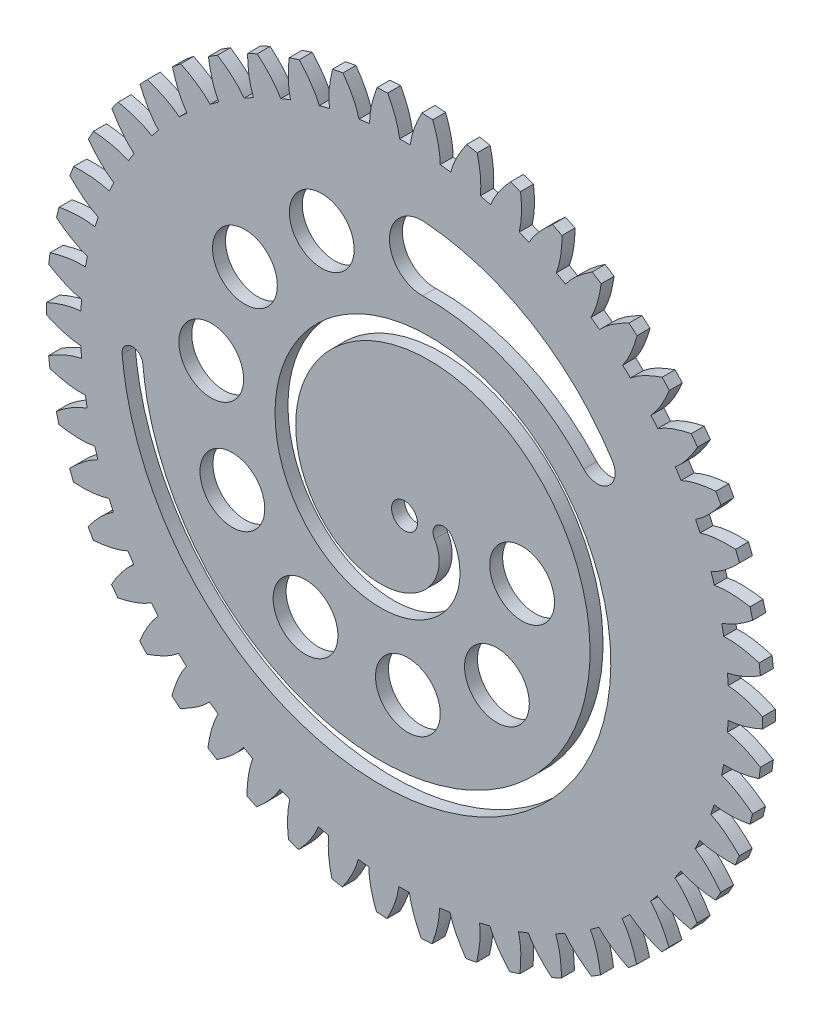
from build123d import *

# Parameters (mm, degrees)
SPIRALSKETCH_R      = 6.35
BOSS_EXTRUDE3_DEPTH = 6.35
SKETCH2_R           = 15.875
CUT_EXTRUDE1_DEPTH  = 6.35


with BuildPart() as part:
    # spiralSketch → Boss-Extrude3 (new body)
    with BuildSketch(Plane.XY):
        with BuildLine():
            Line((30.468459497, 172.815087406), (35.608653157, 171.829582085))
            add(Edge.make_bspline(
                [(37.148806911, 154.342245173), (37.831936538, 160.209299594), (36.978815149, 166.129159813), (35.608653157, 171.829582085)],
                knots=[0, 0, 0, 0, 1, 1, 1, 1], degree=3))
            ThreePointArc((37.148806911, 154.342245173), (39.66463326, 153.714928905), (42.169878451, 153.046606795))
            add(Edge.make_bspline(
                [(42.169878451, 153.046606795), (44.310689074, 158.5527263), (47.962178229, 163.294360615), (51.887680307, 167.633678274)],
                knots=[0, 0, 0, 0, 1, 1, 1, 1], degree=3))
            Line((51.887680307, 167.633678274), (56.863825436, 166.011706865))
            add(Edge.make_bspline(
                [(56.200090136, 148.469230377), (57.613169984, 154.204402477), (57.508730936, 160.184507291), (56.863825436, 166.011706865)],
                knots=[0, 0, 0, 0, 1, 1, 1, 1], degree=3))
            ThreePointArc((56.200090136, 148.469230377), (58.617454866, 147.531544034), (61.01918248, 146.554501362))
            add(Edge.make_bspline(
                [(61.01918248, 146.554501362), (63.833211933, 151.748888752), (68.050192367, 155.995480921), (72.488601402, 159.808585896)],
                knots=[0, 0, 0, 0, 1, 1, 1, 1], degree=3))
            Line((72.488601402, 159.808585896), (77.222221219, 157.575727856))
            add(Edge.make_bspline(
                [(74.365064367, 140.254767126), (76.485809323, 145.767609814), (77.131699681, 151.7136494), (77.222221219, 157.575727856)],
                knots=[0, 0, 0, 0, 1, 1, 1, 1], degree=3))
            ThreePointArc((74.365064367, 140.254767126), (76.645844193, 139.021498582), (78.90617755, 137.751143895))
            add(Edge.make_bspline(
                [(78.90617755, 137.751143895), (82.349046908, 142.551880579), (87.06501432, 146.236459307), (91.94633395, 149.463216654)],
                knots=[0, 0, 0, 0, 1, 1, 1, 1], degree=3))
            Line((91.94633395, 149.463216654), (96.362776443, 146.654685488))
            add(Edge.make_bspline(
                [(91.357257109, 129.828402414), (94.152221758, 135.031974868), (95.538255446, 140.850176629), (96.362776443, 146.654685488)],
                knots=[0, 0, 0, 0, 1, 1, 1, 1], degree=3))
            ThreePointArc((91.357257109, 129.828402414), (93.46548277, 128.31900105), (95.548775063, 126.775368601))
            add(Edge.make_bspline(
                [(95.548775063, 126.775368601), (99.566188221, 131.106744093), (104.706768987, 134.171201371), (109.954017886, 136.7607232)],
                knots=[0, 0, 0, 0, 1, 1, 1, 1], degree=3))
            Line((109.954017886, 136.7607232), (113.983633118, 133.420811122))
            add(Edge.make_bspline(
                [(106.908691333, 117.35456624), (110.333797412, 122.166805014), (112.438115851, 127.765412432), (113.983633118, 133.420811122)],
                knots=[0, 0, 0, 0, 1, 1, 1, 1], degree=3))
            ThreePointArc((106.908691333, 117.35456624), (108.811114851, 115.592836218), (110.684511316, 113.800270012))
            add(Edge.make_bspline(
                [(110.684511316, 113.800270012), (115.213111267, 117.593975932), (120.697235358, 119.98998344), (126.227661276, 121.901431444)],
                knots=[0, 0, 0, 0, 1, 1, 1, 1], degree=3))
            Line((126.227661276, 121.901431444), (129.806899808, 118.082810864))
            add(Edge.make_bspline(
                [(120.77411163, 103.029978452), (124.775343171, 107.374991666), (127.564760002, 112.665711358), (129.806899808, 118.082810864)],
                knots=[0, 0, 0, 0, 1, 1, 1, 1], degree=3))
            ThreePointArc((120.77411163, 103.029978452), (122.44073065, 101.043703306), (124.074686705, 99.030473184))
            add(Edge.make_bspline(
                [(124.074686705, 99.030473184), (129.043054723, 102.226680524), (134.784234227, 103.916451792), (140.510619044, 105.119681294)],
                knots=[0, 0, 0, 0, 1, 1, 1, 1], degree=3))
            Line((140.510619044, 105.119681294), (143.583034146, 100.882574138))
            add(Edge.make_bspline(
                [(132.73485204, 87.080546357), (137.249107231, 90.889810556), (140.679631683, 95.789204712), (143.583034146, 100.882574138)],
                knots=[0, 0, 0, 0, 1, 1, 1, 1], degree=3))
            ThreePointArc((132.73485204, 87.080546357), (134.139382985, 84.901050833), (135.508130167, 82.698906635))
            add(Edge.make_bspline(
                [(135.508130167, 82.698906635), (140.83791212, 85.247209297), (146.745605205, 86.204095622), (152.577640412, 86.680130974)],
                knots=[0, 0, 0, 0, 1, 1, 1, 1], degree=3))
            Line((152.577640412, 86.680130974), (155.094778262, 82.091358955))
            add(Edge.make_bspline(
                [(142.602284541, 69.757802027), (147.558370882, 72.97124284), (151.575901536, 77.402045087), (155.094778262, 82.091358955)],
                knots=[0, 0, 0, 0, 1, 1, 1, 1], degree=3))
            ThreePointArc((142.602284541, 69.757802027), (143.722577118, 67.419458071), (144.804529467, 65.063128928))
            add(Edge.make_bspline(
                [(144.804529467, 65.063128928), (150.41167151, 66.923338655), (156.392710328, 67.132249368), (162.238421245, 66.873583209)],
                knots=[0, 0, 0, 0, 1, 1, 1, 1], degree=3))
            Line((162.238421245, 66.873583209), (164.160585077, 62.005514001))
            add(Edge.make_bspline(
                [(150.220793829, 51.334935487), (155.540550876, 53.901875032), (160.081728874, 57.794208973), (164.160585077, 62.005514001)],
                knots=[0, 0, 0, 0, 1, 1, 1, 1], degree=3))
            ThreePointArc((150.220793829, 51.334935487), (151.039180355, 48.87462018), (151.817274835, 46.40126681))
            add(Edge.make_bspline(
                [(151.817274835, 46.40126681), (157.613348989, 47.544046985), (163.573408985, 47.001687439), (169.340605259, 46.012399088)],
                knots=[0, 0, 0, 0, 1, 1, 1, 1], degree=3))
            Line((169.340605259, 46.012399088), (170.6374814, 40.941805052))
            add(Edge.make_bspline(
                [(155.47023146, 32.102486348), (161.069763468, 33.982442456), (166.062971719, 37.274923658), (170.6374814, 40.941805052)],
                knots=[0, 0, 0, 0, 1, 1, 1, 1], degree=3))
            ThreePointArc((155.47023146, 32.102486348), (155.973805491, 29.559000333), (156.435771088, 27.007628995))
            add(Edge.make_bspline(
                [(156.435771088, 27.007628995), (162.329369801, 27.414957292), (168.174457268, 26.129880822), (173.772186769, 24.425571947)],
                knots=[0, 0, 0, 0, 1, 1, 1, 1], degree=3))
            Line((173.772186769, 24.425571947), (174.423322707, 19.232419379))
            add(Edge.make_bspline(
                [(158.267810668, 12.363761823), (164.058809671, 13.527086463), (169.4253023, 16.167790531), (174.423322707, 19.232419379)],
                knots=[0, 0, 0, 0, 1, 1, 1, 1], degree=3))
            ThreePointArc((158.267810668, 12.363761823), (158.44863054, 9.777217393), (158.587181781, 7.188064738))
            add(Edge.make_bspline(
                [(158.587181781, 7.188064738), (164.48535948, 6.853517346), (170.123293897, 4.845990375), (175.463277087, 2.453538945)],
                knots=[0, 0, 0, 0, 1, 1, 1, 1], degree=3))
            Line((175.463277087, 2.453538945), (175.45840402, -2.780273036))
            add(Edge.make_bspline(
                [(158.569411957, -7.569946612), (164.460550442, -7.141599765), (170.115694653, -5.194318311), (175.45840402, -2.780273036)],
                knots=[0, 0, 0, 0, 1, 1, 1, 1], degree=3))
            ThreePointArc((158.569411957, -7.569946612), (158.424626033, -10.158758106), (158.237577882, -12.744859593))
            add(Edge.make_bspline(
                [(158.237577882, -12.744859593), (164.047316782, -13.816006663), (169.389184555, -16.514324235), (174.387206708, -19.557187831)],
                knots=[0, 0, 0, 0, 1, 1, 1, 1], degree=3))
            Line((174.387206708, -19.557187831), (173.726401487, -24.749118884))
            add(Edge.make_bspline(
                [(156.370278894, -27.384272467), (162.268650088, -27.697658698), (168.12326088, -26.474509651), (173.726401487, -24.749118884)],
                knots=[0, 0, 0, 0, 1, 1, 1, 1], degree=3))
            ThreePointArc((156.370278894, -27.384272467), (155.902170535, -29.934523921), (155.392472853, -32.476789876))
            add(Edge.make_bspline(
                [(155.392472853, -32.476789876), (161.0221499, -34.267643994), (165.983706584, -37.614198087), (170.560945906, -41.259486073)],
                knots=[0, 0, 0, 0, 1, 1, 1, 1], degree=3))
            Line((170.560945906, -41.259486073), (169.254629824, -46.327656344))
            add(Edge.make_bspline(
                [(151.705093123, -46.766731986), (157.517676188, -47.816909008), (163.47942285, -47.337182158), (169.254629824, -46.327656344)],
                knots=[0, 0, 0, 0, 1, 1, 1, 1], degree=3))
            ThreePointArc((151.705093123, -46.766731986), (150.921044677, -49.238204412), (150.0967357, -51.696541782))
            add(Edge.make_bspline(
                [(150.0967357, -51.696541782), (155.457567525, -54.178860108), (159.960566406, -58.120873566), (164.044837099, -62.311097571)],
                knots=[0, 0, 0, 0, 1, 1, 1, 1], degree=3))
            Line((164.044837099, -62.311097571), (162.113611541, -67.175578988))
            add(Edge.make_bspline(
                [(144.647427408, -65.411652205), (150.282554438, -67.182058099), (156.257416664, -67.453319025), (162.113611541, -67.175578988)],
                knots=[0, 0, 0, 0, 1, 1, 1, 1], degree=3))
            ThreePointArc((144.647427408, -65.411652205), (143.559803788, -67.765369005), (142.433883362, -70.101008342))
            add(Edge.make_bspline(
                [(142.433883362, -70.101008342), (147.441326444, -73.235643234), (151.414752541, -77.710948148), (154.941643215, -82.380025839)],
                knots=[0, 0, 0, 0, 1, 1, 1, 1], degree=3))
            Line((154.941643215, -82.380025839), (152.415964762, -86.964102622))
            add(Edge.make_bspline(
                [(135.308585355, -83.024991594), (140.67738703, -85.487706), (146.571137674, -86.505676756), (152.415964762, -86.964102622)],
                knots=[0, 0, 0, 0, 1, 1, 1, 1], degree=3))
            ThreePointArc((135.308585355, -83.024991594), (133.934539034, -85.223833249), (132.524763597, -87.399940124))
            add(Edge.make_bspline(
                [(132.524763597, -87.399940124), (137.099847567, -91.137456517), (140.481037577, -96.075474656), (143.39492706, -101.149771887)],
                knots=[0, 0, 0, 0, 1, 1, 1, 1], degree=3))
            Line((143.39492706, -101.149771887), (140.31462717, -105.381150409))
            add(Edge.make_bspline(
                [(123.835846082, -99.328977268), (128.853653192, -102.445161711), (134.573344285, -104.193788289), (140.31462717, -105.381150409)],
                knots=[0, 0, 0, 0, 1, 1, 1, 1], degree=3))
            ThreePointArc((123.835846082, -99.328977268), (122.197046592, -101.338266732), (120.525649144, -103.32052264))
            add(Edge.make_bspline(
                [(120.525649144, -103.32052264), (124.596222196, -107.601977667), (127.331852731, -112.924833536), (129.586787245, -118.324325609)],
                knots=[0, 0, 0, 0, 1, 1, 1, 1], degree=3))
            Line((129.586787245, -118.324325609), (126.000444087, -122.136274501))
            add(Edge.make_bspline(
                [(110.41014154, -114.066485635), (114.99782027, -117.786996023), (120.453248867, -120.238701538), (126.000444087, -122.136274501)],
                knots=[0, 0, 0, 0, 1, 1, 1, 1], degree=3))
            ThreePointArc((110.41014154, -114.066485635), (108.532433728, -115.854535212), (106.625773205, -117.611678793))
            add(Edge.make_bspline(
                [(106.625773205, -117.611678793), (110.12763997, -122.369551352), (112.174568503, -127.993300333), (113.734986384, -133.632834032)],
                knots=[0, 0, 0, 0, 1, 1, 1, 1], degree=3))
            Line((113.734986384, -133.632834032), (109.699158732, -136.965236585))
            add(Edge.make_bspline(
                [(95.24320311, -127.005097383), (99.328403025, -131.271259045), (104.433533758, -134.387378636), (109.699158732, -136.965236585)],
                knots=[0, 0, 0, 0, 1, 1, 1, 1], degree=3))
            ThreePointArc((95.24320311, -127.005097383), (93.15619955, -128.543708463), (91.044345128, -130.048028514))
            add(Edge.make_bspline(
                [(91.044345128, -130.048028514), (93.922279074, -135.207284112), (95.24822432, -141.043236325), (96.089516846, -146.833872835)],
                knots=[0, 0, 0, 0, 1, 1, 1, 1], degree=3))
            Line((96.089516846, -146.833872835), (91.667852113, -149.634175068))
            add(Edge.make_bspline(
                [(78.574222471, -137.940762877), (82.092517529, -142.685295895), (86.766839437, -146.416686495), (91.667852113, -149.634175068)],
                knots=[0, 0, 0, 0, 1, 1, 1, 1], degree=3))
            ThreePointArc((78.574222471, -137.940762877), (76.310836456, -139.205670644), (74.02709334, -140.433443138))
            add(Edge.make_bspline(
                [(74.02709334, -140.433443138), (76.235707731, -145.912717232), (76.819758741, -151.868836224), (76.928658226, -157.719253748)],
                knots=[0, 0, 0, 0, 1, 1, 1, 1], degree=3))
            Line((76.928658226, -157.719253748), (72.190888706, -159.943293223))
            add(Edge.make_bspline(
                [(60.666079407, -146.701020138), (63.561983992, -151.849100392), (67.731780226, -156.136915742), (72.190888706, -159.943293223)],
                knots=[0, 0, 0, 0, 1, 1, 1, 1], degree=3))
            ThreePointArc((60.666079407, -146.701020138), (58.262005885, -147.672276241), (55.84239007, -148.604138473))
            add(Edge.make_bspline(
                [(55.84239007, -148.604138473), (57.346853736, -154.317019638), (57.179799677, -160.299373854), (56.55458871, -166.117307813)],
                knots=[0, 0, 0, 0, 1, 1, 1, 1], degree=3))
            Line((56.55458871, -166.117307813), (51.57543186, -167.730010099))
            add(Edge.make_bspline(
                [(41.801196029, -153.147714676), (44.029039997, -158.618153866), (47.62855038, -163.394772556), (51.57543186, -167.730010099)],
                knots=[0, 0, 0, 0, 1, 1, 1, 1], degree=3))
            ThreePointArc((41.801196029, -153.147714676), (39.294348678, -153.810001827), (36.777018949, -154.431257773))
            add(Edge.make_bspline(
                [(36.777018949, -154.431257773), (37.553605601, -160.287650459), (36.638081014, -166.2018946), (35.288619547, -171.8955927)],
                knots=[0, 0, 0, 0, 1, 1, 1, 1], degree=3))
            Line((35.288619547, -171.8955927), (30.146599644, -172.871524518))
            add(Edge.make_bspline(
                [(22.27708282, -157.179178268), (23.80173174, -162.885704299), (26.774189842, -168.0757962), (30.146599644, -172.871524518)],
                knots=[0, 0, 0, 0, 1, 1, 1, 1], degree=3))
            ThreePointArc((22.27708282, -157.179178268), (19.706996118, -157.522051802), (17.131652269, -157.822903884))
            add(Edge.make_bspline(
                [(17.131652269, -157.822903884), (17.168114671, -163.730449282), (15.518557928, -169.483312184), (13.466127773, -174.962981405)],
                knots=[0, 0, 0, 0, 1, 1, 1, 1], degree=3))
            Line((13.466127773, -174.962981405), (8.242337542, -175.286751727))
            add(Edge.make_bspline(
                [(2.401646707, -158.731832325), (3.199055955, -164.584449872), (5.497584337, -170.106164134), (8.242337542, -175.286751727)],
                knots=[0, 0, 0, 0, 1, 1, 1, 1], degree=3))
            ThreePointArc((2.401646707, -158.731832325), (-0.191147542, -158.749884922), (-2.7838908, -158.725588523))
            add(Edge.make_bspline(
                [(-2.7838908, -158.725588523), (-3.488127682, -164.591121111), (-5.845702088, -170.091876691), (-8.56873288, -175.271099375)],
                knots=[0, 0, 0, 0, 1, 1, 1, 1], degree=3))
            Line((-8.56873288, -175.271099375), (-13.791911146, -174.937602151))
            add(Edge.make_bspline(
                [(-17.51166481, -157.781190563), (-17.454070854, -163.687600353), (-15.865721358, -169.453856244), (-13.791911146, -174.937602151)],
                knots=[0, 0, 0, 0, 1, 1, 1, 1], degree=3))
            ThreePointArc((-17.51166481, -157.781190563), (-20.086276692, -157.474137523), (-22.655530249, -157.125075813))
            add(Edge.make_bspline(
                [(-22.655530249, -157.125075813), (-24.089360178, -162.856092639), (-27.11777189, -168.017990694), (-30.468459497, -172.815087406)],
                knots=[0, 0, 0, 0, 1, 1, 1, 1], degree=3))
            Line((-30.468459497, -172.815087406), (-35.608653157, -171.829582085))
            add(Edge.make_bspline(
                [(-37.148806911, -154.342245173), (-37.831936538, -160.209299595), (-36.978815149, -166.129159813), (-35.608653157, -171.829582085)],
                knots=[0, 0, 0, 0, 1, 1, 1, 1], degree=3))
            ThreePointArc((-37.148806911, -154.342245173), (-39.664633259, -153.714928905), (-42.169878451, -153.046606795))
            add(Edge.make_bspline(
                [(-42.169878451, -153.046606795), (-44.310689074, -158.5527263), (-47.962178229, -163.294360615), (-51.887680306, -167.633678274)],
                knots=[0, 0, 0, 0, 1, 1, 1, 1], degree=3))
            Line((-51.887680306, -167.633678274), (-56.863825436, -166.011706865))
            add(Edge.make_bspline(
                [(-56.200090136, -148.469230377), (-57.613169984, -154.204402477), (-57.508730936, -160.184507291), (-56.863825436, -166.011706865)],
                knots=[0, 0, 0, 0, 1, 1, 1, 1], degree=3))
            ThreePointArc((-56.200090136, -148.469230377), (-58.617454866, -147.531544034), (-61.01918248, -146.554501362))
            add(Edge.make_bspline(
                [(-61.01918248, -146.554501362), (-63.833211933, -151.748888752), (-68.050192367, -155.995480921), (-72.488601402, -159.808585896)],
                knots=[0, 0, 0, 0, 1, 1, 1, 1], degree=3))
            Line((-72.488601402, -159.808585896), (-77.222221219, -157.575727856))
            add(Edge.make_bspline(
                [(-74.365064367, -140.254767126), (-76.485809323, -145.767609815), (-77.131699681, -151.7136494), (-77.222221219, -157.575727856)],
                knots=[0, 0, 0, 0, 1, 1, 1, 1], degree=3))
            ThreePointArc((-74.365064367, -140.254767126), (-76.645844193, -139.021498582), (-78.90617755, -137.751143896))
            add(Edge.make_bspline(
                [(-78.90617755, -137.751143896), (-82.349046908, -142.551880579), (-87.06501432, -146.236459307), (-91.94633395, -149.463216654)],
                knots=[0, 0, 0, 0, 1, 1, 1, 1], degree=3))
            Line((-91.94633395, -149.463216654), (-96.362776443, -146.654685488))
            add(Edge.make_bspline(
                [(-91.357257109, -129.828402414), (-94.152221758, -135.031974868), (-95.538255446, -140.850176629), (-96.362776443, -146.654685488)],
                knots=[0, 0, 0, 0, 1, 1, 1, 1], degree=3))
            ThreePointArc((-91.357257109, -129.828402414), (-93.46548277, -128.31900105), (-95.548775063, -126.775368601))
            add(Edge.make_bspline(
                [(-95.548775063, -126.775368601), (-99.566188221, -131.106744093), (-104.706768987, -134.171201371), (-109.954017886, -136.7607232)],
                knots=[0, 0, 0, 0, 1, 1, 1, 1], degree=3))
            Line((-109.954017886, -136.7607232), (-113.983633118, -133.420811122))
            add(Edge.make_bspline(
                [(-106.908691333, -117.35456624), (-110.333797412, -122.166805014), (-112.438115851, -127.765412432), (-113.983633118, -133.420811122)],
                knots=[0, 0, 0, 0, 1, 1, 1, 1], degree=3))
            ThreePointArc((-106.908691333, -117.35456624), (-108.811114851, -115.592836218), (-110.684511316, -113.800270012))
            add(Edge.make_bspline(
                [(-110.684511316, -113.800270012), (-115.213111267, -117.593975932), (-120.697235358, -119.98998344), (-126.227661276, -121.901431444)],
                knots=[0, 0, 0, 0, 1, 1, 1, 1], degree=3))
            Line((-126.227661276, -121.901431444), (-129.806899808, -118.082810864))
            add(Edge.make_bspline(
                [(-120.77411163, -103.029978452), (-124.775343171, -107.374991666), (-127.564760002, -112.665711358), (-129.806899808, -118.082810864)],
                knots=[0, 0, 0, 0, 1, 1, 1, 1], degree=3))
            ThreePointArc((-120.77411163, -103.029978452), (-122.44073065, -101.043703306), (-124.074686705, -99.030473184))
            add(Edge.make_bspline(
                [(-124.074686705, -99.030473184), (-129.043054723, -102.226680524), (-134.784234227, -103.916451792), (-140.510619044, -105.119681294)],
                knots=[0, 0, 0, 0, 1, 1, 1, 1], degree=3))
            Line((-140.510619044, -105.119681294), (-143.583034146, -100.882574138))
            add(Edge.make_bspline(
                [(-132.73485204, -87.080546357), (-137.249107231, -90.889810557), (-140.679631683, -95.789204712), (-143.583034146, -100.882574138)],
                knots=[0, 0, 0, 0, 1, 1, 1, 1], degree=3))
            ThreePointArc((-132.73485204, -87.080546357), (-134.139382985, -84.901050833), (-135.508130167, -82.698906636))
            add(Edge.make_bspline(
                [(-135.508130167, -82.698906636), (-140.83791212, -85.247209297), (-146.745605205, -86.204095622), (-152.577640412, -86.680130974)],
                knots=[0, 0, 0, 0, 1, 1, 1, 1], degree=3))
            Line((-152.577640412, -86.680130974), (-155.094778262, -82.091358955))
            add(Edge.make_bspline(
                [(-142.602284541, -69.757802027), (-147.558370882, -72.97124284), (-151.575901536, -77.402045087), (-155.094778262, -82.091358955)],
                knots=[0, 0, 0, 0, 1, 1, 1, 1], degree=3))
            ThreePointArc((-142.602284541, -69.757802027), (-143.722577118, -67.419458071), (-144.804529467, -65.063128928))
            add(Edge.make_bspline(
                [(-144.804529467, -65.063128928), (-150.41167151, -66.923338655), (-156.392710328, -67.132249368), (-162.238421245, -66.873583209)],
                knots=[0, 0, 0, 0, 1, 1, 1, 1], degree=3))
            Line((-162.238421245, -66.873583209), (-164.160585077, -62.005514001))
            add(Edge.make_bspline(
                [(-150.220793829, -51.334935487), (-155.540550876, -53.901875032), (-160.081728874, -57.794208973), (-164.160585077, -62.005514001)],
                knots=[0, 0, 0, 0, 1, 1, 1, 1], degree=3))
            ThreePointArc((-150.220793829, -51.334935487), (-151.039180355, -48.87462018), (-151.817274835, -46.40126681))
            add(Edge.make_bspline(
                [(-151.817274835, -46.40126681), (-157.613348989, -47.544046985), (-163.573408985, -47.001687439), (-169.340605259, -46.012399088)],
                knots=[0, 0, 0, 0, 1, 1, 1, 1], degree=3))
            Line((-169.340605259, -46.012399088), (-170.6374814, -40.941805052))
            add(Edge.make_bspline(
                [(-155.47023146, -32.102486348), (-161.069763468, -33.982442456), (-166.062971719, -37.274923658), (-170.6374814, -40.941805052)],
                knots=[0, 0, 0, 0, 1, 1, 1, 1], degree=3))
            ThreePointArc((-155.47023146, -32.102486348), (-155.973805491, -29.559000333), (-156.435771088, -27.007628996))
            add(Edge.make_bspline(
                [(-156.435771088, -27.007628996), (-162.329369801, -27.414957292), (-168.174457268, -26.129880822), (-173.772186769, -24.425571947)],
                knots=[0, 0, 0, 0, 1, 1, 1, 1], degree=3))
            Line((-173.772186769, -24.425571947), (-174.423322707, -19.232419379))
            add(Edge.make_bspline(
                [(-158.267810668, -12.363761823), (-164.058809671, -13.527086463), (-169.4253023, -16.167790531), (-174.423322707, -19.232419379)],
                knots=[0, 0, 0, 0, 1, 1, 1, 1], degree=3))
            ThreePointArc((-158.267810668, -12.363761823), (-158.44863054, -9.777217393), (-158.587181781, -7.188064739))
            add(Edge.make_bspline(
                [(-158.587181781, -7.188064739), (-164.48535948, -6.853517346), (-170.123293897, -4.845990375), (-175.463277087, -2.453538945)],
                knots=[0, 0, 0, 0, 1, 1, 1, 1], degree=3))
            Line((-175.463277087, -2.453538945), (-175.45840402, 2.780273036))
            add(Edge.make_bspline(
                [(-158.569411957, 7.569946612), (-164.460550442, 7.141599765), (-170.115694653, 5.194318312), (-175.45840402, 2.780273036)],
                knots=[0, 0, 0, 0, 1, 1, 1, 1], degree=3))
            ThreePointArc((-158.569411957, 7.569946612), (-158.424626033, 10.158758106), (-158.237577882, 12.744859593))
            add(Edge.make_bspline(
                [(-158.237577882, 12.744859593), (-164.047316782, 13.816006663), (-169.389184555, 16.514324235), (-174.387206708, 19.557187831)],
                knots=[0, 0, 0, 0, 1, 1, 1, 1], degree=3))
            Line((-174.387206708, 19.557187831), (-173.726401487, 24.749118884))
            add(Edge.make_bspline(
                [(-156.370278894, 27.384272467), (-162.268650088, 27.697658699), (-168.123260879, 26.474509651), (-173.726401487, 24.749118884)],
                knots=[0, 0, 0, 0, 1, 1, 1, 1], degree=3))
            ThreePointArc((-156.370278894, 27.384272467), (-155.902170535, 29.934523921), (-155.392472853, 32.476789876))
            add(Edge.make_bspline(
                [(-155.392472853, 32.476789876), (-161.0221499, 34.267643994), (-165.983706584, 37.614198087), (-170.560945906, 41.259486073)],
                knots=[0, 0, 0, 0, 1, 1, 1, 1], degree=3))
            Line((-170.560945906, 41.259486073), (-169.254629824, 46.327656344))
            add(Edge.make_bspline(
                [(-151.705093123, 46.766731986), (-157.517676188, 47.816909008), (-163.47942285, 47.337182158), (-169.254629824, 46.327656344)],
                knots=[0, 0, 0, 0, 1, 1, 1, 1], degree=3))
            ThreePointArc((-151.705093123, 46.766731986), (-150.921044677, 49.238204412), (-150.0967357, 51.696541782))
            add(Edge.make_bspline(
                [(-150.0967357, 51.696541782), (-155.457567525, 54.178860108), (-159.960566406, 58.120873566), (-164.044837099, 62.311097571)],
                knots=[0, 0, 0, 0, 1, 1, 1, 1], degree=3))
            Line((-164.044837099, 62.311097571), (-162.113611541, 67.175578988))
            add(Edge.make_bspline(
                [(-144.647427408, 65.411652205), (-150.282554438, 67.182058099), (-156.257416664, 67.453319025), (-162.113611541, 67.175578988)],
                knots=[0, 0, 0, 0, 1, 1, 1, 1], degree=3))
            ThreePointArc((-144.647427408, 65.411652205), (-143.559803788, 67.765369005), (-142.433883362, 70.101008342))
            add(Edge.make_bspline(
                [(-142.433883362, 70.101008342), (-147.441326444, 73.235643234), (-151.414752541, 77.710948148), (-154.941643215, 82.380025839)],
                knots=[0, 0, 0, 0, 1, 1, 1, 1], degree=3))
            Line((-154.941643215, 82.380025839), (-152.415964762, 86.964102622))
            add(Edge.make_bspline(
                [(-135.308585355, 83.024991594), (-140.67738703, 85.487706), (-146.571137674, 86.505676756), (-152.415964762, 86.964102622)],
                knots=[0, 0, 0, 0, 1, 1, 1, 1], degree=3))
            ThreePointArc((-135.308585355, 83.024991594), (-133.934539034, 85.223833249), (-132.524763597, 87.399940123))
            add(Edge.make_bspline(
                [(-132.524763597, 87.399940123), (-137.099847567, 91.137456517), (-140.481037577, 96.075474656), (-143.39492706, 101.149771887)],
                knots=[0, 0, 0, 0, 1, 1, 1, 1], degree=3))
            Line((-143.39492706, 101.149771887), (-140.31462717, 105.381150409))
            add(Edge.make_bspline(
                [(-123.835846082, 99.328977268), (-128.853653192, 102.445161711), (-134.573344285, 104.193788289), (-140.31462717, 105.381150409)],
                knots=[0, 0, 0, 0, 1, 1, 1, 1], degree=3))
            ThreePointArc((-123.835846082, 99.328977268), (-122.197046592, 101.338266732), (-120.525649144, 103.320522639))
            add(Edge.make_bspline(
                [(-120.525649144, 103.320522639), (-124.596222196, 107.601977667), (-127.331852731, 112.924833536), (-129.586787245, 118.324325609)],
                knots=[0, 0, 0, 0, 1, 1, 1, 1], degree=3))
            Line((-129.586787245, 118.324325609), (-126.000444087, 122.136274501))
            add(Edge.make_bspline(
                [(-110.41014154, 114.066485635), (-114.99782027, 117.786996023), (-120.453248867, 120.238701538), (-126.000444087, 122.136274501)],
                knots=[0, 0, 0, 0, 1, 1, 1, 1], degree=3))
            ThreePointArc((-110.41014154, 114.066485635), (-108.532433728, 115.854535212), (-106.625773205, 117.611678793))
            add(Edge.make_bspline(
                [(-106.625773205, 117.611678793), (-110.12763997, 122.369551352), (-112.174568503, 127.993300333), (-113.734986384, 133.632834032)],
                knots=[0, 0, 0, 0, 1, 1, 1, 1], degree=3))
            Line((-113.734986384, 133.632834032), (-109.699158732, 136.965236585))
            add(Edge.make_bspline(
                [(-95.24320311, 127.005097383), (-99.328403025, 131.271259045), (-104.433533758, 134.387378636), (-109.699158732, 136.965236585)],
                knots=[0, 0, 0, 0, 1, 1, 1, 1], degree=3))
            ThreePointArc((-95.24320311, 127.005097383), (-93.15619955, 128.543708463), (-91.044345128, 130.048028514))
            add(Edge.make_bspline(
                [(-91.044345128, 130.048028514), (-93.922279074, 135.207284112), (-95.24822432, 141.043236325), (-96.089516846, 146.833872835)],
                knots=[0, 0, 0, 0, 1, 1, 1, 1], degree=3))
            Line((-96.089516846, 146.833872835), (-91.667852113, 149.634175068))
            add(Edge.make_bspline(
                [(-78.574222471, 137.940762877), (-82.092517529, 142.685295895), (-86.766839437, 146.416686495), (-91.667852113, 149.634175068)],
                knots=[0, 0, 0, 0, 1, 1, 1, 1], degree=3))
            ThreePointArc((-78.574222471, 137.940762877), (-76.310836456, 139.205670644), (-74.02709334, 140.433443138))
            add(Edge.make_bspline(
                [(-74.02709334, 140.433443138), (-76.235707731, 145.912717232), (-76.819758741, 151.868836224), (-76.928658226, 157.719253748)],
                knots=[0, 0, 0, 0, 1, 1, 1, 1], degree=3))
            Line((-76.928658226, 157.719253748), (-72.190888706, 159.943293223))
            add(Edge.make_bspline(
                [(-60.666079407, 146.701020138), (-63.561983992, 151.849100392), (-67.731780226, 156.136915742), (-72.190888706, 159.943293223)],
                knots=[0, 0, 0, 0, 1, 1, 1, 1], degree=3))
            ThreePointArc((-60.666079407, 146.701020138), (-58.262005885, 147.672276241), (-55.84239007, 148.604138473))
            add(Edge.make_bspline(
                [(-55.84239007, 148.604138473), (-57.346853736, 154.317019638), (-57.179799677, 160.299373854), (-56.55458871, 166.117307813)],
                knots=[0, 0, 0, 0, 1, 1, 1, 1], degree=3))
            Line((-56.55458871, 166.117307813), (-51.57543186, 167.730010099))
            add(Edge.make_bspline(
                [(-41.801196029, 153.147714676), (-44.029039997, 158.618153866), (-47.62855038, 163.394772556), (-51.57543186, 167.730010099)],
                knots=[0, 0, 0, 0, 1, 1, 1, 1], degree=3))
            ThreePointArc((-41.801196029, 153.147714676), (-39.294348678, 153.810001827), (-36.777018949, 154.431257773))
            add(Edge.make_bspline(
                [(-36.777018949, 154.431257773), (-37.553605601, 160.287650459), (-36.638081014, 166.2018946), (-35.288619547, 171.8955927)],
                knots=[0, 0, 0, 0, 1, 1, 1, 1], degree=3))
            Line((-35.288619547, 171.8955927), (-30.146599644, 172.871524518))
            add(Edge.make_bspline(
                [(-22.27708282, 157.179178268), (-23.80173174, 162.885704299), (-26.774189842, 168.0757962), (-30.146599644, 172.871524518)],
                knots=[0, 0, 0, 0, 1, 1, 1, 1], degree=3))
            ThreePointArc((-22.27708282, 157.179178268), (-19.706996118, 157.522051802), (-17.131652269, 157.822903884))
            add(Edge.make_bspline(
                [(-17.131652269, 157.822903884), (-17.168114671, 163.730449282), (-15.518557928, 169.483312184), (-13.466127773, 174.962981405)],
                knots=[0, 0, 0, 0, 1, 1, 1, 1], degree=3))
            Line((-13.466127773, 174.962981405), (-8.242337542, 175.286751727))
            add(Edge.make_bspline(
                [(-2.401646707, 158.731832325), (-3.199055955, 164.584449872), (-5.497584336, 170.106164134), (-8.242337542, 175.286751727)],
                knots=[0, 0, 0, 0, 1, 1, 1, 1], degree=3))
            ThreePointArc((-2.401646707, 158.731832325), (0.191147542, 158.749884922), (2.7838908, 158.725588523))
            add(Edge.make_bspline(
                [(2.7838908, 158.725588523), (3.488127682, 164.591121111), (5.845702088, 170.091876691), (8.56873288, 175.271099375)],
                knots=[0, 0, 0, 0, 1, 1, 1, 1], degree=3))
            Line((8.56873288, 175.271099375), (13.791911146, 174.937602151))
            add(Edge.make_bspline(
                [(17.51166481, 157.781190563), (17.454070854, 163.687600353), (15.865721358, 169.453856244), (13.791911146, 174.937602151)],
                knots=[0, 0, 0, 0, 1, 1, 1, 1], degree=3))
            ThreePointArc((17.51166481, 157.781190563), (20.086276692, 157.474137523), (22.655530249, 157.125075813))
            add(Edge.make_bspline(
                [(22.655530249, 157.125075813), (24.089360178, 162.856092639), (27.11777189, 168.017990694), (30.468459497, 172.815087406)],
                knots=[0, 0, 0, 0, 1, 1, 1, 1], degree=3))
        make_face()
        Circle(SPIRALSKETCH_R, mode=Mode.SUBTRACT)
        with BuildLine():
            ThreePointArc((14.669480914, -2.572440969), (16.477559031, 4.380519086), (23.430519086, 2.572440969))
            add(Edge.make_bspline(
                [(23.430519086, 2.572440969), (23.557739077, 2.355802528), (23.802453263, 1.938637536), (24.355438476, 0.96707066), (25.079354153, -0.487643873), (25.725898394, -2.181831213), (26.420042866, -4.420551325), (27.001071497, -7.345793036), (27.293412485, -12.000016595), (26.583135457, -17.749154287), (23.479633795, -26.311476892), (16.568073919, -35.27608501), (5.282530144, -42.306261597), (-7.4459411, -45.395972428), (-20.375714636, -44.709007952), (-32.543213368, -40.646201074), (-46.811392967, -31.432587379), (-59.647674517, -14.276799622), (-65.088455546, 10.524296431), (-60.718427342, 35.295651529), (-47.92822702, 56.740109059), (-28.825869282, 72.585959752), (-5.809733211, 81.535537894), (18.727776485, 83.140548702), (42.603048458, 77.643657573), (63.967872044, 65.813366354), (81.377550176, 48.785446825), (93.814730208, 27.919665934), (100.680895827, 4.675921604), (101.764435404, -19.486677635), (97.194868902, -43.192629657), (87.387406298, -65.208026636), (72.984130832, -84.485033778), (54.794345752, -100.186332238), (33.738498719, -111.697499634), (10.7951517, -118.627959212), (-13.045478194, -120.801849414), (-36.821756404, -118.242207875), (-59.634075972, -111.149926776), (-80.671607115, -99.878602143), (-99.231940082, -84.909256651), (-114.736379419, -66.816785965), (-124.733331241, -49.689848578), (-130.064442263, -36.907758903), (-132.610943911, -29.43687079), (-134.28507053, -23.771107503), (-135.726394787, -18.013974627), (-136.882603263, -12.138576881), (-137.719302316, -6.291904184), (-138.168436961, -2.506326704), (-138.394671136, -0.598074522)],
                knots=[0, 0, 0, 0, 0.000976562, 0.001953125, 0.00390625, 0.005859375, 0.0078125, 0.01171875, 0.015625, 0.0234375, 0.03125, 0.046875, 0.0625, 0.078125, 0.09375, 0.109375, 0.125, 0.15625, 0.1875, 0.21875, 0.25, 0.28125, 0.3125, 0.34375, 0.375, 0.40625, 0.4375, 0.46875, 0.5, 0.53125, 0.5625, 0.59375, 0.625, 0.65625, 0.6875, 0.71875, 0.75, 0.78125, 0.8125, 0.84375, 0.875, 0.90625, 0.9375, 0.953125, 0.9609375, 0.96875, 0.9765625, 0.984375, 0.9921875, 1, 1, 1, 1], degree=3))
            ThreePointArc((-138.394671136, -0.598074522), (-133.948074522, 5.044671136), (-128.305328864, 0.598074522))
            add(Edge.make_bspline(
                [(14.669480914, -2.572440969), (14.782978065, -2.765711268), (15.01958173, -3.168738065), (15.403910807, -3.849930108), (15.736870928, -4.521072899), (16.113847195, -5.49375204), (16.545367694, -6.88821854), (16.891560534, -8.632848446), (17.082836997, -11.582599461), (16.626089558, -15.329519171), (14.5307707, -21.152780432), (9.652264101, -27.540014072), (1.322476057, -32.762156635), (-8.36254238, -35.132593754), (-18.429219073, -34.611820476), (-28.075301686, -31.401857341), (-39.555475036, -24.002899045), (-50.100575328, -9.97798119), (-53.904947156, 7.245015932), (-52.837991868, 21.168105719), (-49.176812483, 34.692368625), (-40.081839835, 49.980054941), (-23.609100476, 63.662234802), (-3.600218719, 71.455826117), (17.878781283, 72.870705143), (38.90246122, 68.038952497), (57.813934002, 57.575311809), (73.296376925, 42.441013527), (84.403566578, 23.816901652), (90.560030636, 2.99233502), (91.538300173, -18.730036359), (87.421309919, -40.107578881), (78.555355751, -60.017786789), (65.498770776, -77.497356505), (48.968904875, -91.769407126), (29.790570906, -102.256991239), (8.848609047, -108.585268262), (-12.955487438, -110.575538465), (-34.741075588, -108.232145081), (-55.679930239, -101.724090893), (-75.021376937, -91.363571449), (-92.112506473, -77.580358759), (-106.408613516, -60.902322259), (-115.646323907, -45.074495813), (-120.565647103, -33.280744841), (-122.92428236, -26.362350837), (-124.482990405, -21.087775904), (-125.810926716, -15.776492808), (-126.856092005, -10.467463061), (-127.636704908, -5.034573131), (-128.084050095, -1.268379539), (-128.305328864, 0.598074522)],
                knots=[0, 0, 0, 0, 0.000976562, 0.001953125, 0.00390625, 0.005859375, 0.0078125, 0.01171875, 0.015625, 0.0234375, 0.03125, 0.046875, 0.0625, 0.078125, 0.09375, 0.109375, 0.125, 0.15625, 0.1875, 0.203125, 0.21875, 0.25, 0.28125, 0.3125, 0.34375, 0.375, 0.40625, 0.4375, 0.46875, 0.5, 0.53125, 0.5625, 0.59375, 0.625, 0.65625, 0.6875, 0.71875, 0.75, 0.78125, 0.8125, 0.84375, 0.875, 0.90625, 0.9375, 0.953125, 0.9609375, 0.96875, 0.9765625, 0.984375, 0.9921875, 1, 1, 1, 1], degree=3))
        make_face(mode=Mode.SUBTRACT)
    extrude(amount=BOSS_EXTRUDE3_DEPTH)

    # Sketch2 → Cut-Extrude1 (cut)
    with BuildSketch(Plane.XY.offset(6.35)):
        with Locations((57.631685705, 0)):
            Circle(SKETCH2_R)
        with Locations((45.280423739, -49.275615956)):
            Circle(SKETCH2_R)
        with Locations((1.644529186, -75.286165866)):
            Circle(SKETCH2_R)
        with Locations((-48.518355442, -67.265878727)):
            Circle(SKETCH2_R)
        with Locations((-84.363278361, -31.268913564)):
            Circle(SKETCH2_R)
        with Locations((-94.736614091, 18.460694376)):
            Circle(SKETCH2_R)
        with Locations((-78.215298714, 66.499076303)):
            Circle(SKETCH2_R)
        with Locations((-40.562135656, 100.600092589)):
            Circle(SKETCH2_R)
        with BuildLine():
            ThreePointArc((87.823160595, 63.711089524), (99.700358566, 62.573666136), (101.82029623, 74.315362262))
            ThreePointArc((101.82029623, 74.315362262), (62.315623678, 112.85033168), (9.721411416, 129.56594887))
            ThreePointArc((9.721411416, 129.56594887), (-7.376409181, 114.109057022), (8.907232128, 97.796669076))
            ThreePointArc((8.907232128, 97.796669076), (52.10101, 89.403144055), (87.823160595, 63.711089524))
        make_face()
    extrude(amount=-CUT_EXTRUDE1_DEPTH, mode=Mode.SUBTRACT)


solid = part.part
